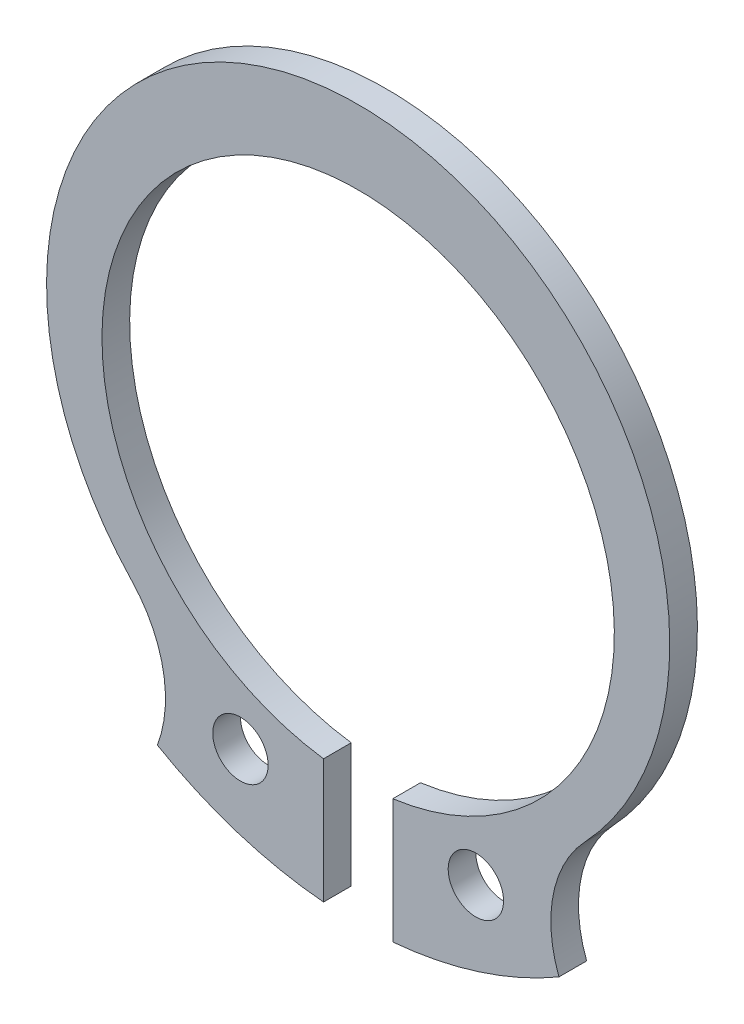
from build123d import *

# Parameters (mm, degrees)
EXTRUDE_991_DEPTH      = 0.5
EXTRUDE_991_DEPTH_BACK = 0.5
SKETCH_1_R             = 1


with BuildPart() as part:
    # 草图1 → Extrude 991 (new, two sides: drawn at the far end of the back side and taken through both)
    with BuildSketch(Plane.XY.offset(-EXTRUDE_991_DEPTH_BACK)):
        with BuildLine():
            Line((-1.25, -9.83515139), (-1.25, -14.315530029))
            ThreePointArc((-1.25, -14.315530029), (-4.355811387, -13.693933225), (-7.25, -12.407030265))
            ThreePointArc((-7.25, -12.407030265), (-7.042959472, -9.929441632), (-8.18310536, -7.720057427))
            ThreePointArc((-8.18310536, -7.720057427), (0, 11.25), (8.18310536, -7.720057427))
            ThreePointArc((8.18310536, -7.720057427), (7.042959472, -9.929441632), (7.25, -12.407030265))
            ThreePointArc((7.25, -12.407030265), (4.355811387, -13.693933225), (1.25, -14.315530029))
            Line((1.25, -14.315530029), (1.25, -9.83515139))
            ThreePointArc((1.25, -9.83515139), (0, 8.58), (-1.25, -9.83515139))
        make_face()
        with Locations((-4.25, -11.032311518)):
            Circle(SKETCH_1_R, mode=Mode.SUBTRACT)
        with Locations((4.25, -11.032311518)):
            Circle(SKETCH_1_R, mode=Mode.SUBTRACT)
    extrude(amount=EXTRUDE_991_DEPTH + EXTRUDE_991_DEPTH_BACK)


solid = part.part
